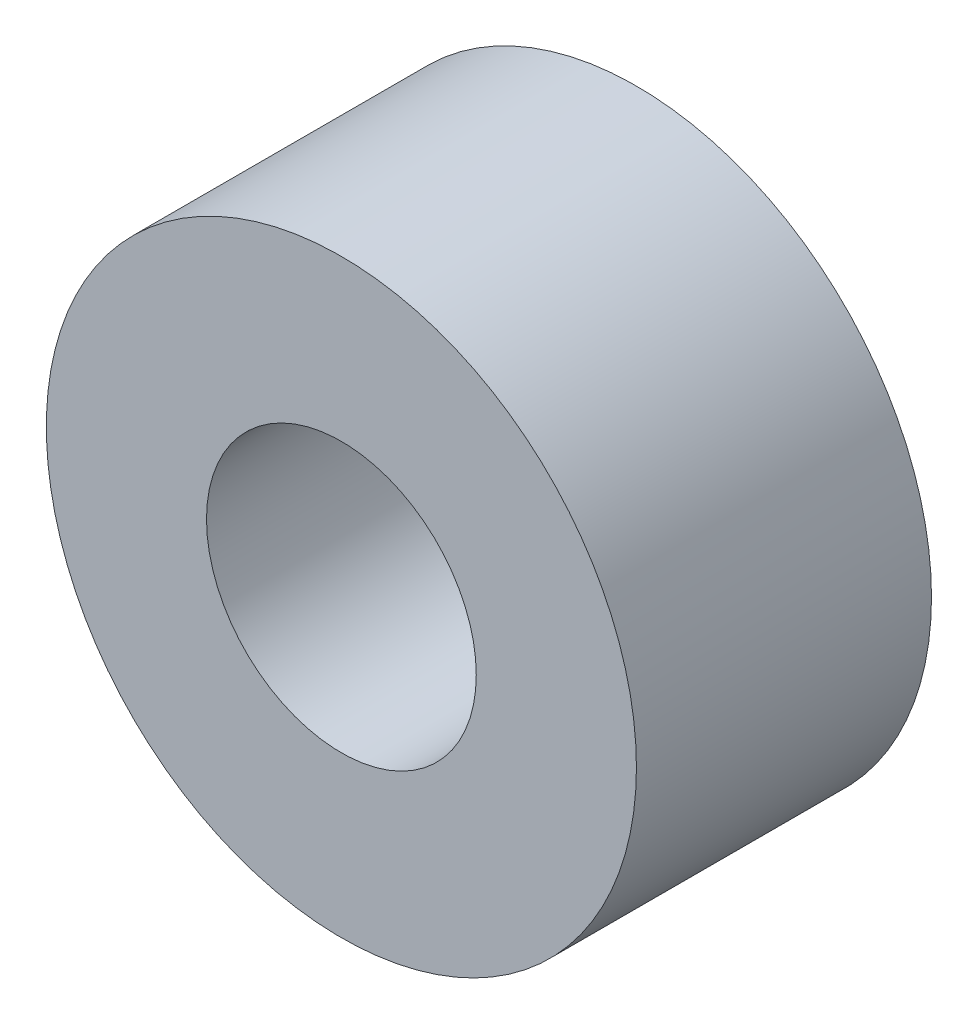
from build123d import *

# Parameters (mm, degrees)
SKETCH_1_R      = 3.5
SKETCH_1_R_2    = 1.6
EXTRUDE_1_DEPTH = 3.5


with BuildPart() as part:
    # ｽｹｯﾁ1 → ﾎﾞｽ - 押し出し1 (new body)
    with BuildSketch(Plane.XY):
        Circle(SKETCH_1_R)
        Circle(SKETCH_1_R_2, mode=Mode.SUBTRACT)
    extrude(amount=EXTRUDE_1_DEPTH)


solid = part.part
